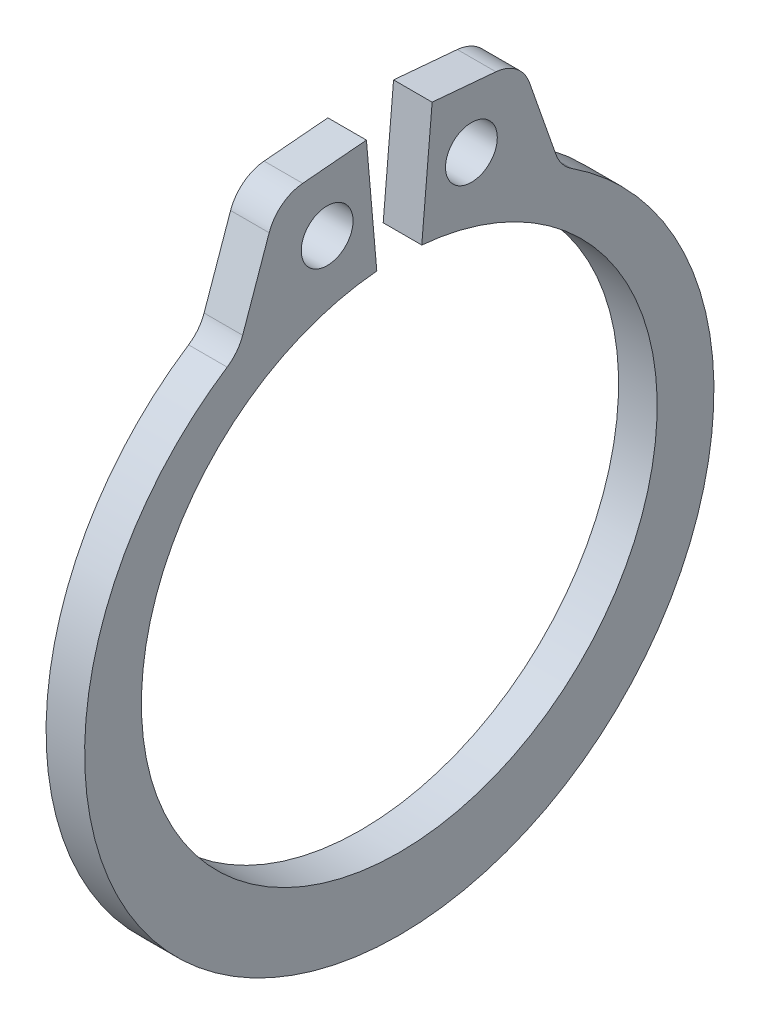
from build123d import *

# Parameters (mm, degrees)
SKETCH1_R      = 0.5969
EXTRUDE1_DEPTH = 0.4445
FILLET1_R      = 0.9017


with BuildPart() as part:
    # Sketch1 → Extrude1 (new, symmetric)
    with BuildSketch(Plane(origin=(0, 0, 0), x_dir=(0, 0, -1), z_dir=(1, 0, 0))):
        with BuildLine():
            Line((-0.518018873, 5.920982808), (-0.757104506, 8.653744103))
            Line((-0.757104506, 8.653744103), (-2.806675478, 8.474429878))
            Line((-2.806675478, 8.474429878), (-3.714142755, 5.885675471))
            ThreePointArc((-3.714142755, 5.885675471), (0, -7.5946), (3.714142755, 5.885675471))
            Line((3.714142755, 5.885675471), (2.806675478, 8.474429878))
            Line((2.806675478, 8.474429878), (0.757104506, 8.653744103))
            Line((0.757104506, 8.653744103), (0.518018873, 5.920982808))
            ThreePointArc((0.518018873, 5.920982808), (0, -5.9436), (-0.518018873, 5.920982808))
        make_face()
        with Locations((-1.662347175, 7.197706343)):
            Circle(SKETCH1_R, mode=Mode.SUBTRACT)
        with Locations((1.662347175, 7.197706343)):
            Circle(SKETCH1_R, mode=Mode.SUBTRACT)
    extrude(amount=EXTRUDE1_DEPTH, both=True)

    # Fillet1
    fillet1_edges = [part.edges().sort_by_distance(p)[0] for p in [
        (0, 8.474429878, -2.806675478),
        (0, 5.885675471, -3.714142755),
        (0, 5.885675471, 3.714142755),
        (0, 8.474429878, 2.806675478),
    ]]
    fillet(fillet1_edges, radius=FILLET1_R)


solid = part.part
